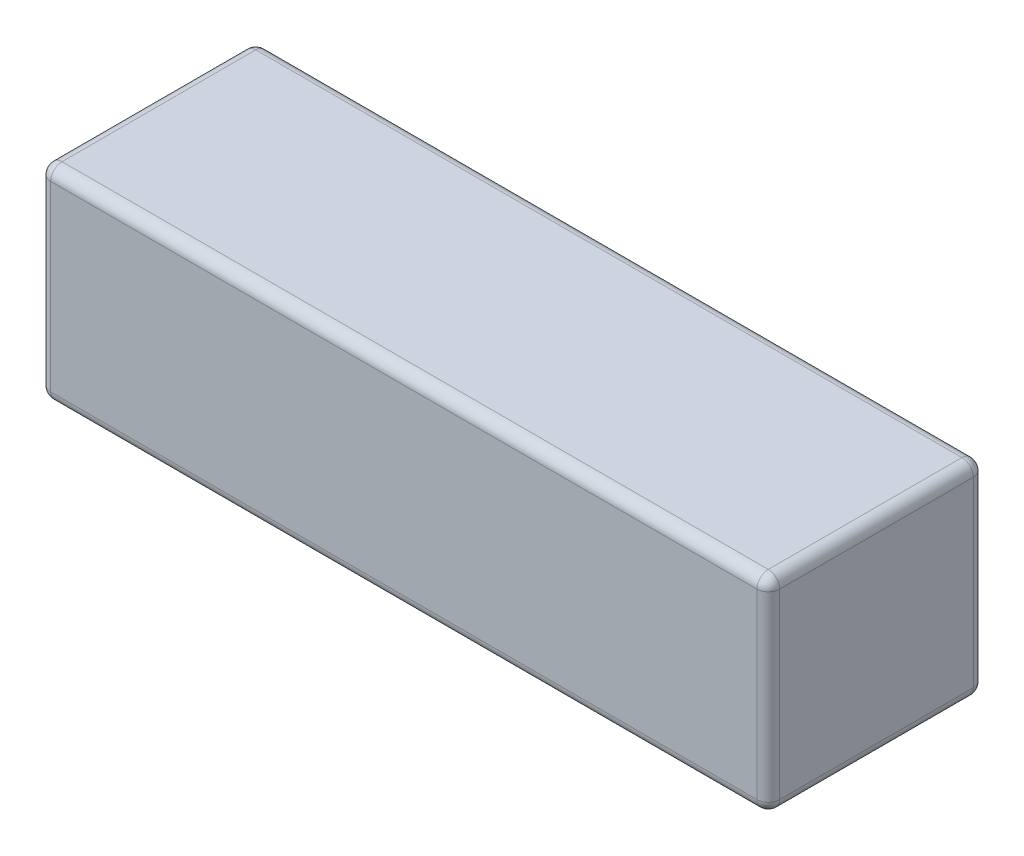
from build123d import *

# Parameters (mm, degrees)
SKETCH1_W           = 64
SKETCH1_H           = 19
BOSS_EXTRUDE1_DEPTH = 18
FILLET1_R           = 1


with BuildPart() as part:
    # Sketch1 → Boss-Extrude1 (new body)
    with BuildSketch(Plane(origin=(0, 0, 0), x_dir=(1, 0, 0), z_dir=(0, 1, 0))):
        with Locations((32, 9.5)):
            Rectangle(SKETCH1_W, SKETCH1_H)
    extrude(amount=BOSS_EXTRUDE1_DEPTH)

    # Fillet1
    fillet1_edges = [part.edges().sort_by_distance(p)[0] for p in [
        (64, 18, -9.5),
        (32, 18, -19),
        (0, 18, -9.5),
        (32, 0, -19),
        (64, 0, -9.5),
        (32, 0, 0),
        (0, 0, -9.5),
        (0, 9, -19),
        (64, 9, -19),
        (64, 9, 0),
        (0, 9, 0),
        (32, 18, 0),
    ]]
    fillet(fillet1_edges, radius=FILLET1_R)


solid = part.part
